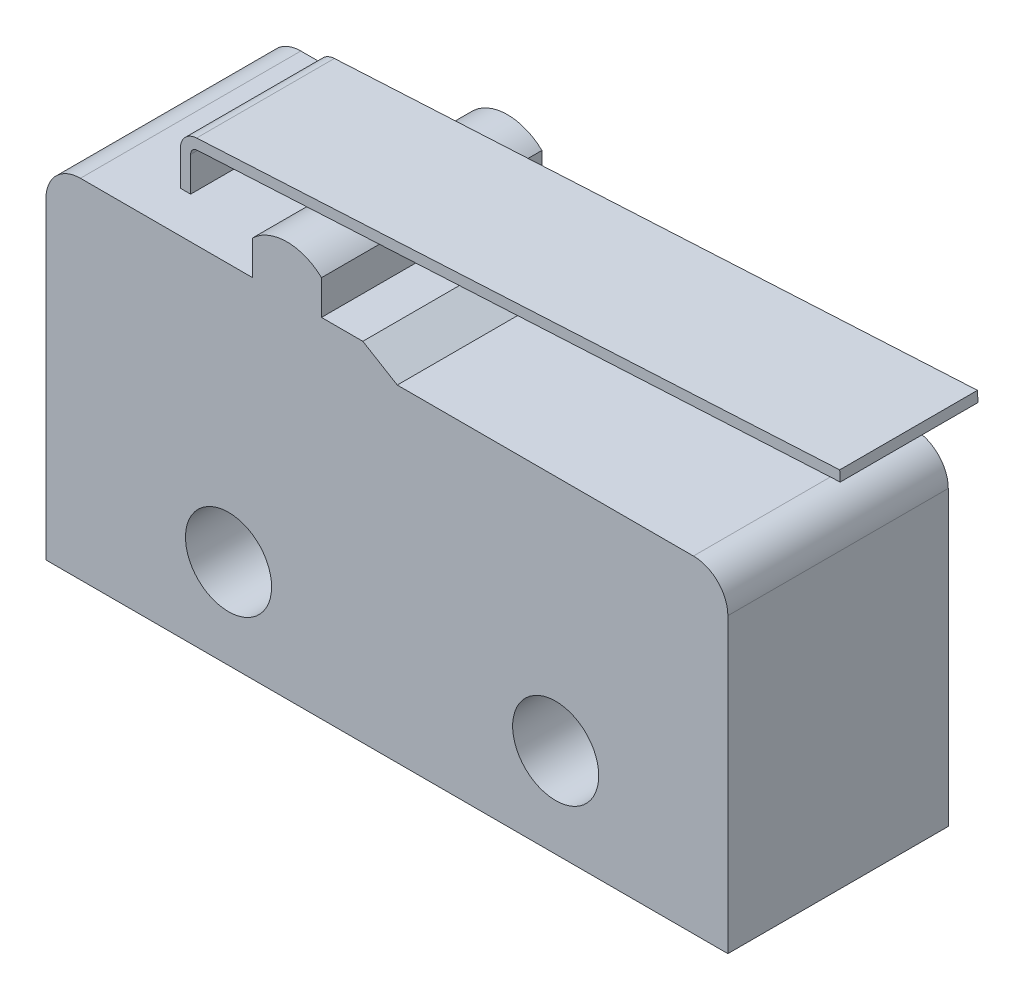
from build123d import *

# Parameters (mm, degrees)
SKETCH1_R           = 1.25
BOSS_EXTRUDE1_DEPTH = 3.2
EXTRUDE_THIN2_DEPTH = 2


with BuildPart() as part:
    # Sketch1 → Boss-Extrude1 (new, symmetric)
    with BuildSketch(Plane.XY):
        with BuildLine():
            Line((-5.3, -2.6), (14.5, -2.6))
            Line((14.5, -2.6), (14.5, 5.9))
            ThreePointArc((14.5, 5.9), (14.207106781, 6.607106781), (13.5, 6.9))
            Line((13.5, 6.9), (4.9, 6.9))
            Line((4.9, 6.9), (3.9, 7.5))
            Line((3.9, 7.5), (2.7, 7.5))
            Line((2.7, 7.5), (2.7, 8.5))
            ThreePointArc((2.7, 8.5), (1.7, 8.9), (0.7, 8.5))
            Line((0.7, 8.5), (0.7, 7.5))
            Line((0.7, 7.5), (-4.3, 7.5))
            ThreePointArc((-4.3, 7.5), (-5.007106781, 7.207106781), (-5.3, 6.5))
            Line((-5.3, 6.5), (-5.3, -2.6))
        make_face()
        Circle(SKETCH1_R, mode=Mode.SUBTRACT)
        with Locations((9.5, 0)):
            Circle(SKETCH1_R, mode=Mode.SUBTRACT)
    extrude(amount=BOSS_EXTRUDE1_DEPTH, both=True)


with BuildPart() as body_2:
    # Sketch2 → Extrude-Thin2 (new, symmetric)
    with BuildSketch(Plane.XY):
        with BuildLine():
            Line((-2.3, 7.5), (-2.3, 8.5))
            ThreePointArc((-2.3, 8.5), (-2.245122034, 8.637621202), (-2.110604047, 8.699718688))
            Line((-2.110604047, 8.699718688), (16.563093247, 9.691197067))
            Line((16.563093247, 9.691197067), (16.547187177, 9.990775098))
            Line((16.547187177, 9.990775098), (-2.126510117, 8.999296719))
            ThreePointArc((-2.126510117, 8.999296719), (-2.462805084, 8.844053006), (-2.6, 8.5))
            Line((-2.6, 8.5), (-2.6, 7.5))
            Line((-2.6, 7.5), (-2.3, 7.5))
        make_face()
    extrude(amount=EXTRUDE_THIN2_DEPTH, both=True)


solid = Compound([part.part, body_2.part])
